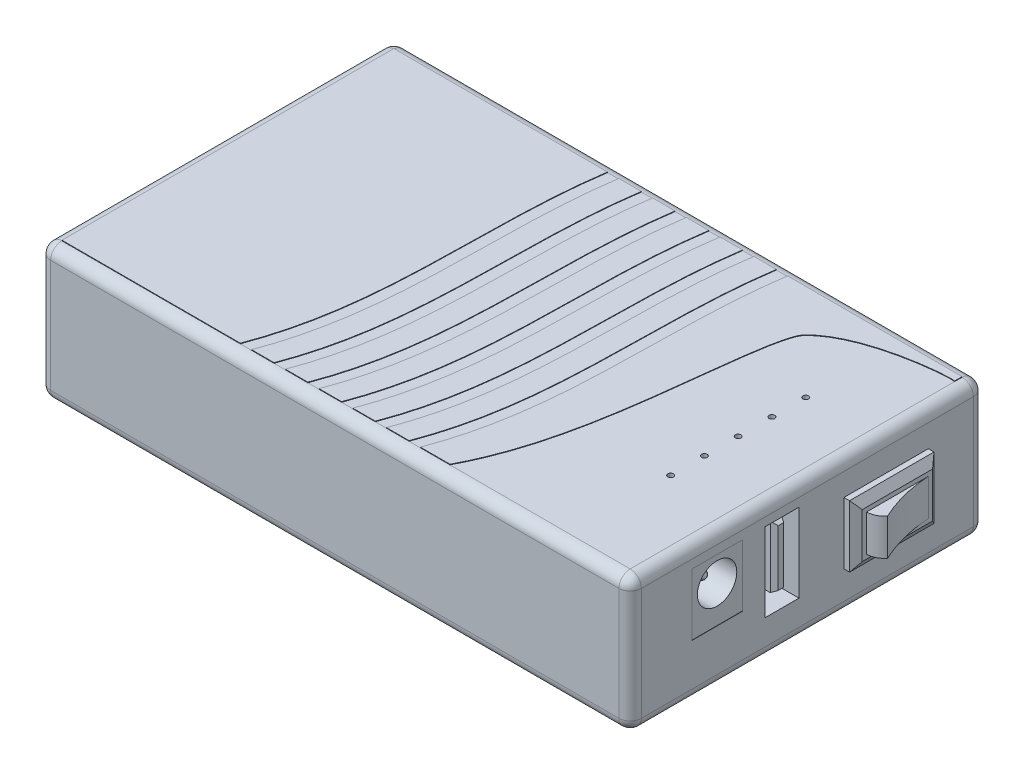
from build123d import *
from OCP.BRepFilletAPI import BRepFilletAPI_MakeChamfer

# Parameters (mm, degrees)
SKETCH2_W           = 105
SKETCH2_H           = 63
BOSS_EXTRUDE1_DEPTH = 24
SKETCH3_W           = 9
SKETCH3_H           = 11
CUT_EXTRUDE1_DEPTH  = 0.05
SKETCH3_3_W         = 6
SKETCH3_3_H         = 14
CUT_EXTRUDE2_DEPTH  = 11
SKETCH3_4_W         = 15
SKETCH3_4_H         = 11
BOSS_EXTRUDE2_DEPTH = 1
SKETCH6_W           = 11
SKETCH6_H           = 6.5
BOSS_EXTRUDE3_DEPTH = 2.5
CUT_EXTRUDE3_DEPTH  = 128.188098893
FILLET1_R           = 2
SKETCH9_R           = 3.5
CUT_EXTRUDE4_DEPTH  = 10
BOSS_EXTRUDE4_DEPTH = 0.1
SKETCH11_R          = 0.5
CUT_EXTRUDE5_DEPTH  = 1
SKETCH12_R          = 2.5
CUT_EXTRUDE6_DEPTH  = 5
CUT_EXTRUDE7_DEPTH  = 0.05
SKETCH14_R          = 0.75
BOSS_EXTRUDE5_DEPTH = 8
FILLET2_R           = 0.75
SKETCH15_W          = 2
SKETCH15_H          = 11
BOSS_EXTRUDE6_DEPTH = 10
CHAMFER2_SIZE       = 0.9
CHAMFER2_SIZE2      = 0.519615242


with BuildPart() as part:
    # Sketch2 → Boss-Extrude1 (new body)
    with BuildSketch(Plane(origin=(0, 0, 0), x_dir=(1, 0, 0), z_dir=(0, 1, 0))):
        with Locations((52.5, 31.5)):
            Rectangle(SKETCH2_W, SKETCH2_H)
    extrude(amount=BOSS_EXTRUDE1_DEPTH)

    # Sketch3 → Cut-Extrude1 (cut)
    with BuildSketch(Plane(origin=(105, 0, 0), x_dir=(0, 0, -1), z_dir=(1, 0, 0))):
        with Locations((15.5, 15)):
            Rectangle(SKETCH3_W, SKETCH3_H)
    extrude(amount=-CUT_EXTRUDE1_DEPTH, mode=Mode.SUBTRACT)

    # Sketch3<3> → Cut-Extrude2 (cut)
    with BuildSketch(Plane(origin=(105, 0, 0), x_dir=(0, 0, -1), z_dir=(1, 0, 0))):
        with Locations((27, 13.5)):
            Rectangle(SKETCH3_3_W, SKETCH3_3_H)
    extrude(amount=-CUT_EXTRUDE2_DEPTH, mode=Mode.SUBTRACT)

    # Sketch3<4> → Boss-Extrude2 (add)
    with BuildSketch(Plane(origin=(105, 0, 0), x_dir=(0, 0, -1), z_dir=(1, 0, 0))):
        with Locations((45.5, 12.5)):
            Rectangle(SKETCH3_4_W, SKETCH3_4_H)
    extrude(amount=BOSS_EXTRUDE2_DEPTH)

    # Sketch5 → section 1 of loft3
    with BuildSketch(Plane(origin=(107, 0, 0), x_dir=(0, 0, -1), z_dir=(1, 0, 0)), mode=Mode.PRIVATE) as loft3_s1:
        with BuildLine():
            Line((39.25, 16.5), (51.75, 16.5))
            Line((51.75, 16.5), (51.75, 8.5))
            Line((51.75, 8.5), (39.25, 8.5))
            Line((39.25, 8.5), (39.25, 16.5))
        make_face()
    # loft from a face of the part (loft3)
    loft([part.faces().sort_by_distance((106, 12.5, -45.5))[0], loft3_s1.sketch])

    # Sketch6 → Boss-Extrude3 (add)
    with BuildSketch(Plane(origin=(107, 0, 0), x_dir=(0, 0, -1), z_dir=(1, 0, 0))):
        with Locations((45.5, 12.5)):
            Rectangle(SKETCH6_W, SKETCH6_H)
    extrude(amount=BOSS_EXTRUDE3_DEPTH)

    # Sketch8 → Cut-Extrude3 (cut, through all)
    with BuildSketch(Plane.XZ.offset(-9.25)):
        with BuildLine():
            ThreePointArc((109.5, -41.25), (107.777815786, -46.003927125), (107, -51))
            Line((107, -51), (109.5, -51))
            Line((109.5, -51), (109.5, -41.25))
        make_face()
        with BuildLine():
            ThreePointArc((107, -40), (108.382080547, -40.360838905), (109.5, -41.25))
            Line((109.5, -41.25), (109.5, -40))
            Line((109.5, -40), (107, -40))
        make_face()
    extrude(amount=-CUT_EXTRUDE3_DEPTH, mode=Mode.SUBTRACT)

    # Fillet1
    fillet1_edges = [part.edges().sort_by_distance(p)[0] for p in [
        (0, 12, 0),
        (0, 0, -31.5),
        (0, 24, -31.5),
        (0, 12, -63),
        (52.5, 24, -63),
        (52.5, 0, -63),
        (105, 12, -63),
        (105, 0, -31.5),
        (105, 24, -31.5),
        (105, 12, 0),
        (52.5, 0, 0),
        (52.5, 24, 0),
    ]]
    fillet(fillet1_edges, radius=FILLET1_R)

    # Sketch9 → Cut-Extrude4 (cut)
    with BuildSketch(Plane(origin=(104.95, 0, 0), x_dir=(0, 0, -1), z_dir=(1, 0, 0))):
        with Locations((15.5, 16)):
            Circle(SKETCH9_R)
    extrude(amount=-CUT_EXTRUDE4_DEPTH, mode=Mode.SUBTRACT)

    # Sketch10 → Boss-Extrude4 (add)
    with BuildSketch(Plane(origin=(0, 24, 0), x_dir=(1, 0, 0), z_dir=(0, 1, 0))):
        with BuildLine():
            Line((70.970468754, 2), (65.707078079, 2))
            add(Edge.make_bspline(
                [(65.707078079, 2), (72.906626661, 21.087182454), (69.043655607, 41.350605764), (71.994633575, 61)],
                knots=[0, 0, 0, 0, 1, 1, 1, 1], degree=3))
            Line((71.994633575, 61), (103, 61))
            Line((103, 61), (103, 59.688500541))
            add(Edge.make_bspline(
                [(103, 59.688500541), (100.793179796, 59.937762049), (87.368628023, 58.597582123), (82.605231661, 53.422629971)],
                knots=[0, 0, 0, 0, 1, 1, 1, 1], degree=3))
            add(Edge.make_bspline(
                [(82.605231661, 53.422629971), (80.465377293, 51.676680645), (78.981797834, 35.060590702), (78.981797834, 17.158731894), (70.970468754, 2)],
                knots=[0, 0, 0, 0, 0, 1, 1, 1, 1, 1], degree=4))
        make_face()
        with BuildLine():
            Line((63.707078079, 2), (59.707078079, 2))
            add(Edge.make_bspline(
                [(59.707078079, 2), (66.906626661, 21.087182454), (63.043655607, 41.350605764), (65.994633575, 61)],
                knots=[0, 0, 0, 0, 1, 1, 1, 1], degree=3))
            Line((65.994633575, 61), (69.994633575, 61))
            add(Edge.make_bspline(
                [(63.707078079, 2), (70.906626661, 21.087182454), (67.043655607, 41.350605764), (69.994633575, 61)],
                knots=[0, 0, 0, 0, 1, 1, 1, 1], degree=3))
        make_face()
        with BuildLine():
            Line((63.994633575, 61), (59.994633575, 61))
            add(Edge.make_bspline(
                [(53.707078079, 2), (60.906626661, 21.087182454), (57.043655607, 41.350605764), (59.994633575, 61)],
                knots=[0, 0, 0, 0, 1, 1, 1, 1], degree=3))
            Line((53.707078079, 2), (57.707078079, 2))
            add(Edge.make_bspline(
                [(57.707078079, 2), (64.906626661, 21.087182454), (61.043655607, 41.350605764), (63.994633575, 61)],
                knots=[0, 0, 0, 0, 1, 1, 1, 1], degree=3))
        make_face()
        with BuildLine():
            Line((57.994633575, 61), (53.994633575, 61))
            add(Edge.make_bspline(
                [(47.707078079, 2), (54.906626661, 21.087182454), (51.043655607, 41.350605764), (53.994633575, 61)],
                knots=[0, 0, 0, 0, 1, 1, 1, 1], degree=3))
            Line((47.707078079, 2), (51.707078079, 2))
            add(Edge.make_bspline(
                [(51.707078079, 2), (58.906626661, 21.087182454), (55.043655607, 41.350605764), (57.994633575, 61)],
                knots=[0, 0, 0, 0, 1, 1, 1, 1], degree=3))
        make_face()
        with BuildLine():
            Line((51.994633575, 61), (47.994633575, 61))
            add(Edge.make_bspline(
                [(41.707078079, 2), (48.906626661, 21.087182454), (45.043655607, 41.350605764), (47.994633575, 61)],
                knots=[0, 0, 0, 0, 1, 1, 1, 1], degree=3))
            Line((41.707078079, 2), (45.707078079, 2))
            add(Edge.make_bspline(
                [(45.707078079, 2), (52.906626661, 21.087182454), (49.043655607, 41.350605764), (51.994633575, 61)],
                knots=[0, 0, 0, 0, 1, 1, 1, 1], degree=3))
        make_face()
        with BuildLine():
            Line((45.994633575, 61), (41.994633575, 61))
            add(Edge.make_bspline(
                [(35.707078079, 2), (42.906626661, 21.087182454), (39.043655607, 41.350605764), (41.994633575, 61)],
                knots=[0, 0, 0, 0, 1, 1, 1, 1], degree=3))
            Line((35.707078079, 2), (39.707078079, 2))
            add(Edge.make_bspline(
                [(39.707078079, 2), (46.906626661, 21.087182454), (43.043655607, 41.350605764), (45.994633575, 61)],
                knots=[0, 0, 0, 0, 1, 1, 1, 1], degree=3))
        make_face()
        with BuildLine():
            Line((33.707078079, 2), (2, 2))
            Line((2, 2), (2, 61))
            Line((2, 61), (39.994633575, 61))
            add(Edge.make_bspline(
                [(33.707078079, 2), (40.906626661, 21.087182454), (37.043655607, 41.350605764), (39.994633575, 61)],
                knots=[0, 0, 0, 0, 1, 1, 1, 1], degree=3))
        make_face()
    extrude(amount=BOSS_EXTRUDE4_DEPTH)

    # Sketch11 → Cut-Extrude5 (cut)
    with BuildSketch(Plane(origin=(0, 24, 0), x_dir=(1, 0, 0), z_dir=(0, 1, 0))):
        with Locations((92.2, 20)):
            Circle(SKETCH11_R)
        with Locations((92.2, 26)):
            Circle(SKETCH11_R)
        with Locations((92.2, 32)):
            Circle(SKETCH11_R)
        with Locations((92.2, 38)):
            Circle(SKETCH11_R)
        with Locations((92.2, 44)):
            Circle(SKETCH11_R)
    extrude(amount=-CUT_EXTRUDE5_DEPTH, mode=Mode.SUBTRACT)

    # Sketch12 → Cut-Extrude6 (cut)
    with BuildSketch(Plane.XZ):
        with Locations((99, -6)):
            Circle(SKETCH12_R)
        with Locations((99, -57)):
            Circle(SKETCH12_R)
    cut_extrude6 = extrude(amount=-CUT_EXTRUDE6_DEPTH, mode=Mode.SUBTRACT)

    # Mirror1: Cut-Extrude6 across plane
    add(cut_extrude6.mirror(Plane(origin=(52.5, 0, 0), x_dir=(0, 0, 1), z_dir=(1, 0, 0))), mode=Mode.SUBTRACT)

    # Sketch13 → Cut-Extrude7 (cut)
    with BuildSketch(Plane.XZ):
        with BuildLine():
            Line((33, -11), (90, -11))
            ThreePointArc((90, -11), (91.414213562, -11.585786438), (92, -13))
            Line((92, -13), (92, -50))
            ThreePointArc((92, -50), (91.414213562, -51.414213562), (90, -52))
            Line((90, -52), (33, -52))
            ThreePointArc((33, -52), (31.585786438, -51.414213562), (31, -50))
            Line((31, -50), (31, -13))
            ThreePointArc((31, -13), (31.585786438, -11.585786438), (33, -11))
        make_face()
    extrude(amount=-CUT_EXTRUDE7_DEPTH, mode=Mode.SUBTRACT)

    # Sketch14 → Boss-Extrude5 (add)
    with BuildSketch(Plane(origin=(94.95, 0, 0), x_dir=(0, 0, -1), z_dir=(1, 0, 0))):
        with Locations((15.5, 16)):
            Circle(SKETCH14_R)
    extrude(amount=BOSS_EXTRUDE5_DEPTH)

    # Fillet2
    fillet2_edges = [part.edges().sort_by_distance(p)[0] for p in [
        (102.95, 16, -14.75),
    ]]
    fillet(fillet2_edges, radius=FILLET2_R)

    # Sketch15 → Boss-Extrude6 (add)
    with BuildSketch(Plane(origin=(94, 0, 0), x_dir=(0, 0, -1), z_dir=(1, 0, 0))):
        with Locations((27.8, 13.5)):
            Rectangle(SKETCH15_W, SKETCH15_H)
    extrude(amount=BOSS_EXTRUDE6_DEPTH)

    # Chamfer2: one chamfer whose edges measure the first distance from different faces: ONE call of the kernel's chamfer builder (chamfer() names one face for all edges)
    chamfer2_edges_1 = [part.edges().sort_by_distance(p)[0] for p in [
        (104, 13.5, -28.8),
    ]]
    chamfer2_side_1 = [part.faces().sort_by_distance(p)[0] for p in [
        (99, 13.5, -28.8),
    ]]
    chamfer2_edges_2 = [part.edges().sort_by_distance(p)[0] for p in [
        (104, 19, -27.8),
    ]]
    chamfer2_side_2 = [part.faces().sort_by_distance(p)[0] for p in [
        (99, 19, -27.8),
    ]]
    chamfer2_edges_3 = [part.edges().sort_by_distance(p)[0] for p in [
        (104, 8, -27.8),
    ]]
    chamfer2_side_3 = [part.faces().sort_by_distance(p)[0] for p in [
        (99, 8, -27.8),
    ]]
    chamfer2_edges_4 = [part.edges().sort_by_distance(p)[0] for p in [
        (104, 13.5, -26.8),
    ]]
    chamfer2_side_4 = [part.faces().sort_by_distance(p)[0] for p in [
        (99, 13.5, -26.8),
    ]]
    chamfer2 = BRepFilletAPI_MakeChamfer(part.part.solid().wrapped)
    for e in chamfer2_edges_1:
        chamfer2.Add(CHAMFER2_SIZE, CHAMFER2_SIZE2, e.wrapped, chamfer2_side_1[0].wrapped)  # the first distance lies on this face
    for e in chamfer2_edges_2:
        chamfer2.Add(CHAMFER2_SIZE, CHAMFER2_SIZE2, e.wrapped, chamfer2_side_2[0].wrapped)  # the first distance lies on this face
    for e in chamfer2_edges_3:
        chamfer2.Add(CHAMFER2_SIZE, CHAMFER2_SIZE2, e.wrapped, chamfer2_side_3[0].wrapped)  # the first distance lies on this face
    for e in chamfer2_edges_4:
        chamfer2.Add(CHAMFER2_SIZE, CHAMFER2_SIZE2, e.wrapped, chamfer2_side_4[0].wrapped)  # the first distance lies on this face
    add(Compound.cast(chamfer2.Shape()), mode=Mode.REPLACE)


solid = part.part
